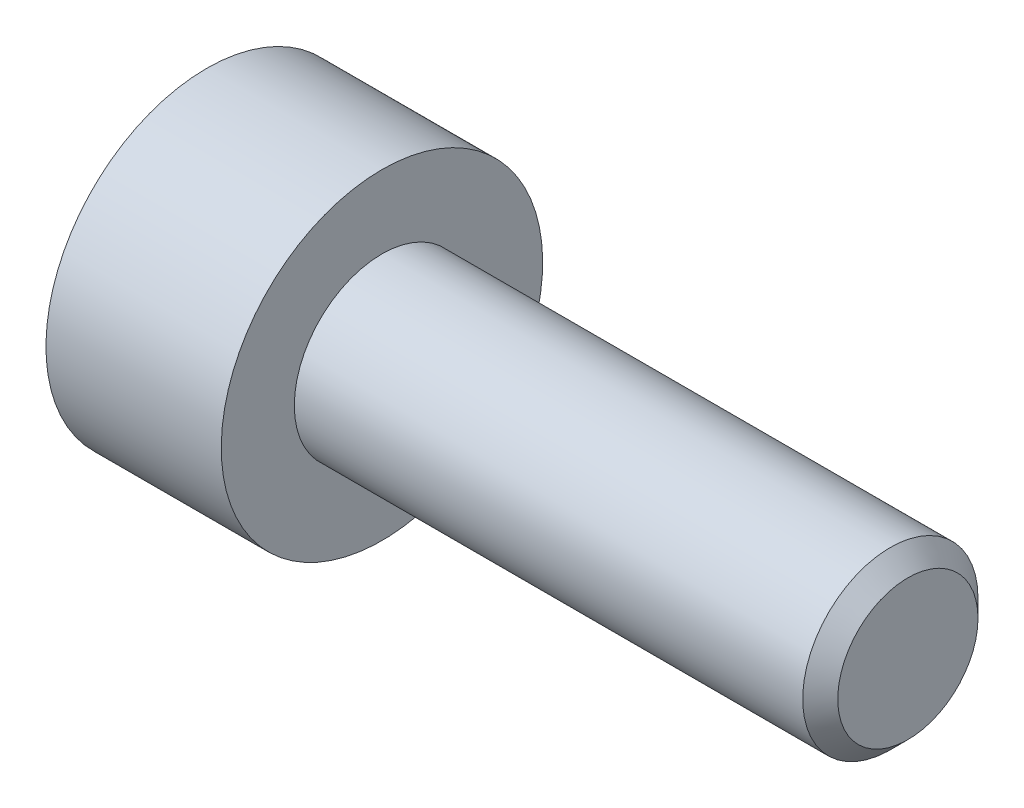
from build123d import *

# Parameters (mm, degrees)
SKETCH2_R           = 1.5
BOSS_EXTRUDE1_DEPTH = 9
CHAMFER1_SIZE       = 0.3
SKETCH6_W           = 3
SKETCH6_H           = 2.75
CUT_EXTRUDE1_DEPTH  = 1.6
SKETCH8_R           = 1.493375673
CUT_EXTRUDE2_DEPTH  = 1
CUT_EXTRUDE2_DRAFT  = -45


with BuildPart() as part:
    # Sketch2 → Boss-Extrude1 (new body)
    with BuildSketch(Plane(origin=(0, 0, 0), x_dir=(0, 0, -1), z_dir=(1, 0, 0))):
        Circle(SKETCH2_R)
    extrude(amount=-BOSS_EXTRUDE1_DEPTH)

    # Chamfer1
    chamfer1_edges = [part.edges().sort_by_distance(p)[0] for p in [
        (0, 0, 1.5),
    ]]
    chamfer(chamfer1_edges, length=CHAMFER1_SIZE)

    # Sketch6 → Revolve1 (revolve)
    with BuildSketch(Plane.XY):
        with Locations((-10.5, 1.375)):
            Rectangle(SKETCH6_W, SKETCH6_H)
    revolve(axis=Axis((-9, 0, 0), (-1, 0, 0)))

    # Sketch7 → Cut-Extrude1 (cut)
    with BuildSketch(Plane.ZY.offset(12)):
        Polygon((0, 1.443375673), (-1.25, 0.721687836), (-1.25, -0.721687836), (0, -1.443375673), (1.25, -0.721687836), (1.25, 0.721687836), align=None)
    extrude(amount=-CUT_EXTRUDE1_DEPTH, mode=Mode.SUBTRACT)


with BuildPart() as cut_extrude2_tool:
    # Sketch8 → Cut-Extrude2 (with draft: the straight prism first)
    with BuildSketch(Plane.ZY.offset(12)):
        Circle(SKETCH8_R)
    extrude(amount=-CUT_EXTRUDE2_DEPTH)
    # Cut-Extrude2: the draft: its side faces are tilted about the plane it starts from
    cut_extrude2_sides = [cut_extrude2_tool.faces().sort_by_distance(p)[0] for p in [
        (-11.5, 0, -1.493375673),
    ]]
    draft(cut_extrude2_sides, Plane.ZY.offset(12), CUT_EXTRUDE2_DRAFT)


with BuildPart() as part_1:
    add(part.part)

    # Cut-Extrude2: cut by cut_extrude2_tool
    add(cut_extrude2_tool.part, mode=Mode.SUBTRACT)


solid = part_1.part
